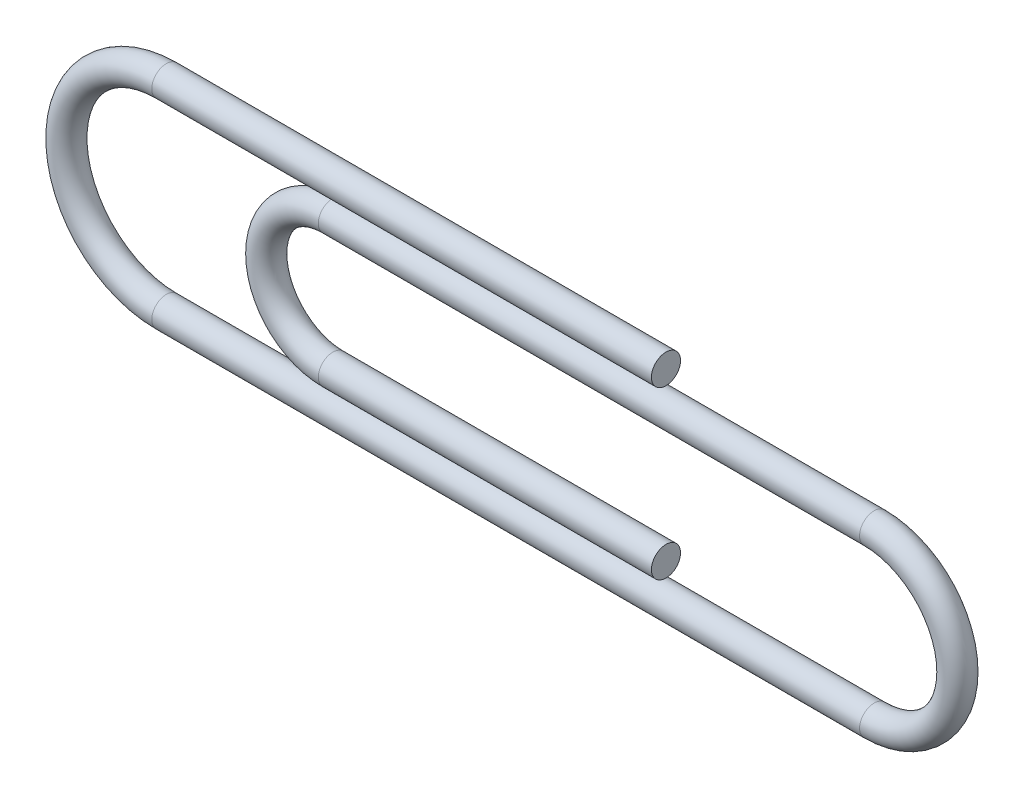
from build123d import *

# Parameters (mm, degrees)
SKETCH2_R = 2.2225


with BuildPart() as part:
    # Sweep1: sweep along a path in Sketch1
    with BuildLine(Plane.XY) as sweep1_path:
        Line((0, 0), (-50.8, 0))
        ThreePointArc((-50.8, 0), (-60.96, 10.16), (-50.8, 20.32))
        Line((-50.8, 20.32), (31.75, 20.32))
        ThreePointArc((31.75, 20.32), (44.45, 7.62), (31.75, -5.08))
        Line((31.75, -5.08), (-76.2, -5.08))
        ThreePointArc((-76.2, -5.08), (-91.44, 10.16), (-76.2, 25.4))
        Line((-76.2, 25.4), (0, 25.4))
    # Sketch2 → Sweep1 (sweep)
    with BuildSketch(Plane(origin=(0, 0, 0), x_dir=(0, 0, -1), z_dir=(1, 0, 0))):
        Circle(SKETCH2_R)
    sweep(path=sweep1_path.line)


solid = part.part
